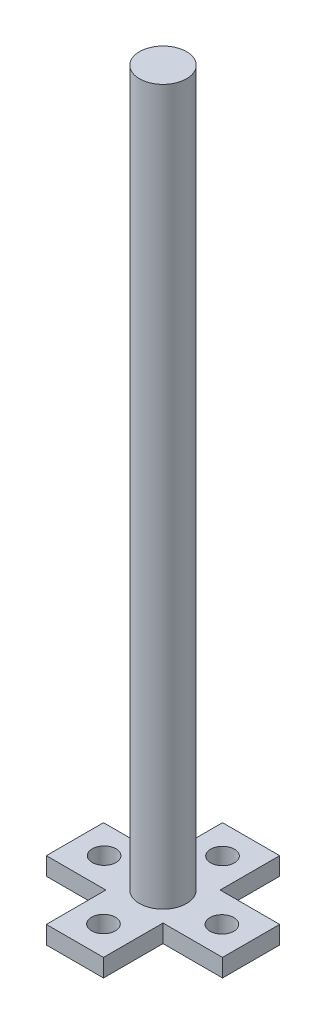
from build123d import *

# Parameters (mm, degrees)
SKETCH_1_W      = 10
SKETCH_1_H      = 9.6
SKETCH_1_R      = 2
SKETCH_1_W_2    = 9.6
SKETCH_1_H_2    = 10
SKETCH_1_R_2    = 4
EXTRUDE_2_DEPTH = 3
SKETCH_2_R      = 3.95
EXTRUDE_3_DEPTH = 120


with BuildPart() as part:
    # 草图1 → 凸台-拉伸2 (new body)
    # profile 1 of 6: a face of its own
    with BuildSketch(Plane(origin=(0, 0, 0), x_dir=(1, 0, 0), z_dir=(0, 1, 0))):
        with Locations((-9.8, 0)):
            Rectangle(SKETCH_1_W, SKETCH_1_H)
        with Locations(Location((-9.946440474, 0.053559526, 0), (0, 0, 270))):
            Circle(SKETCH_1_R, mode=Mode.SUBTRACT)
    # profile 2 of 6: a face of its own
    with BuildSketch(Plane(origin=(0, 0, 0), x_dir=(1, 0, 0), z_dir=(0, 1, 0))):
        with Locations((0, -9.8)):
            Rectangle(SKETCH_1_W_2, SKETCH_1_H_2)
        with Locations(Location((-0.053559526, -9.946440474, 0), (0, 0, 270))):
            Circle(SKETCH_1_R, mode=Mode.SUBTRACT)
    # profile 3 of 6: a face of its own
    with BuildSketch(Plane(origin=(0, 0, 0), x_dir=(1, 0, 0), z_dir=(0, 1, 0))):
        Rectangle(SKETCH_1_W_2, SKETCH_1_H)
        Circle(SKETCH_1_R_2, mode=Mode.SUBTRACT)
    # profile 4 of 6: a face of its own
    with BuildSketch(Plane(origin=(0, 0, 0), x_dir=(1, 0, 0), z_dir=(0, 1, 0))):
        with Locations((9.8, 0)):
            Rectangle(SKETCH_1_W, SKETCH_1_H)
        with Locations(Location((9.946440474, -0.053559526, 0), (0, 0, 270))):
            Circle(SKETCH_1_R, mode=Mode.SUBTRACT)
    # profile 5 of 6: a face of its own
    with BuildSketch(Plane(origin=(0, 0, 0), x_dir=(1, 0, 0), z_dir=(0, 1, 0))):
        with Locations((0, 9.8)):
            Rectangle(SKETCH_1_W_2, SKETCH_1_H_2)
        with Locations(Location((0.053559526, 9.946440474, 0), (0, 0, 270))):
            Circle(SKETCH_1_R, mode=Mode.SUBTRACT)
    # profile 6 of 6: a face of its own
    with BuildSketch(Plane(origin=(0, 0, 0), x_dir=(1, 0, 0), z_dir=(0, 1, 0))):
        Circle(SKETCH_1_R_2)
    extrude(amount=EXTRUDE_2_DEPTH)

    # 草图2 → 凸台-拉伸3 (add)
    with BuildSketch(Plane(origin=(0, 3, 0), x_dir=(1, 0, 0), z_dir=(0, 1, 0))):
        with Locations(Location((0, 0, 0), (0, 0, 270))):
            Circle(SKETCH_2_R)
    extrude(amount=EXTRUDE_3_DEPTH)


solid = part.part
